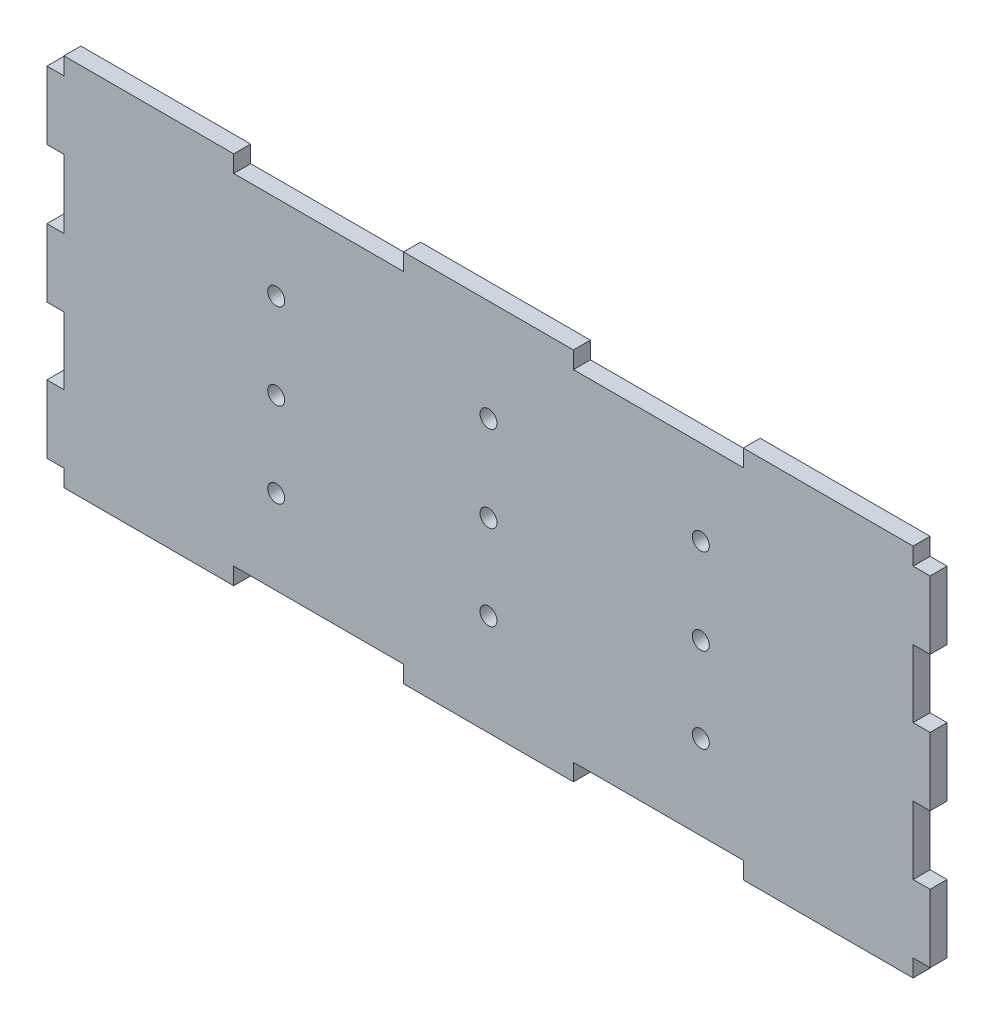
from build123d import *

# Parameters (mm, degrees)
ESBO_O1_R                = 1.5
RESSALTO_EXTRUS_O1_DEPTH = 3


with BuildPart() as part:
    # Esboço1 → Ressalto-extrusão1 (new body)
    with BuildSketch(Plane.XY):
        Polygon((40.700385396, -30.0684829), (10.700385396, -30.0684829), (10.700385396, -33.0684829), (-19.299614604, -33.0684829), (-19.299614604, -30.0684829), (-49.299614604, -30.0684829), (-49.299614604, -33.0684829), (-79.299614604, -33.0684829), (-79.299614604, -30.0684829), (-82.299614604, -30.0684829), (-82.299614604, -18.0684829), (-79.299614604, -18.0684829), (-79.299614604, -6.178045813), (-82.299614604, -6.178045813), (-82.299614604, 5.821954187), (-79.299614604, 5.821954187), (-79.299614604, 17.9315171), (-82.299614604, 17.9315171), (-82.299614604, 29.9315171), (-79.299614604, 29.9315171), (-79.299614604, 33), (-49.299614604, 33), (-49.299614604, 30), (-19.299614604, 30), (-19.299614604, 33), (10.700385396, 33), (10.700385396, 30), (40.700385396, 30), (40.700385396, 33), (70.700385396, 33), (70.700385396, 29.9315171), (73.700385396, 29.9315171), (73.700385396, 17.9315171), (70.700385396, 17.9315171), (70.700385396, 5.999991894), (73.700385396, 5.999991894), (73.700385396, -6.000008106), (70.700385396, -6.000008106), (70.700385396, -18.000008106), (73.700385396, -18.000008106), (73.700385396, -30.000008106), (70.700385396, -30.000008106), (70.700385396, -33.0684829), (40.700385396, -33.0684829), align=None)
        with Locations((33.200385396, 15)):
            Circle(ESBO_O1_R, mode=Mode.SUBTRACT)
        with Locations((-4.299614604, -0.178045813)):
            Circle(ESBO_O1_R, mode=Mode.SUBTRACT)
        with Locations((-41.799614604, 15)):
            Circle(ESBO_O1_R, mode=Mode.SUBTRACT)
        with Locations((-41.799614604, -0.178045813)):
            Circle(ESBO_O1_R, mode=Mode.SUBTRACT)
        with Locations((-4.299614604, -15.178045813)):
            Circle(ESBO_O1_R, mode=Mode.SUBTRACT)
        with Locations((-41.799614604, -15.178045813)):
            Circle(ESBO_O1_R, mode=Mode.SUBTRACT)
        with Locations((33.200385396, -0.178045813)):
            Circle(ESBO_O1_R, mode=Mode.SUBTRACT)
        with Locations((33.200385396, -15.178045813)):
            Circle(ESBO_O1_R, mode=Mode.SUBTRACT)
        with Locations((-4.299614604, 15)):
            Circle(ESBO_O1_R, mode=Mode.SUBTRACT)
    extrude(amount=RESSALTO_EXTRUS_O1_DEPTH)


solid = part.part
